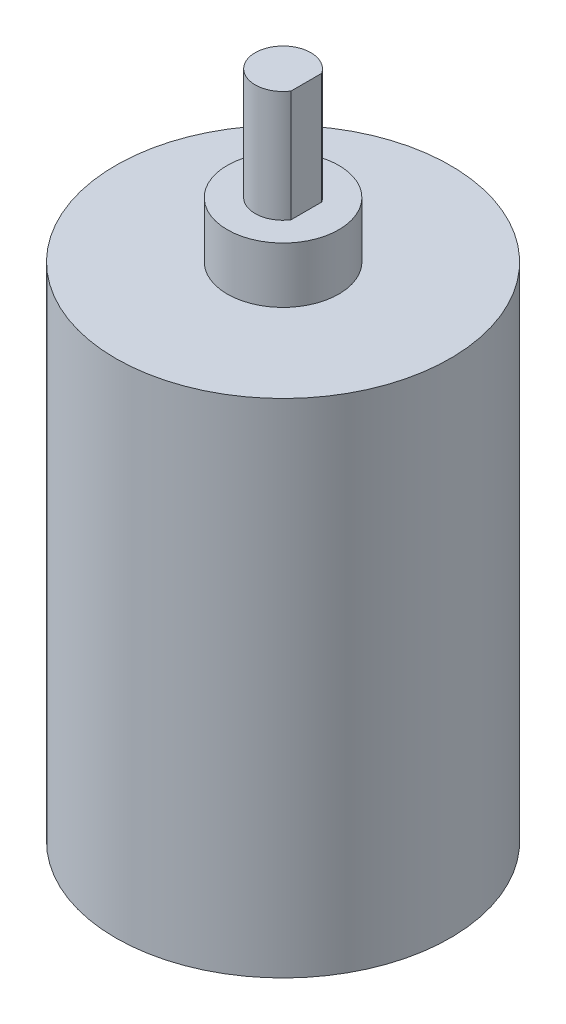
from build123d import *

# Parameters (mm, degrees)
SKETCH1_R           = 19.05
BOSS_EXTRUDE1_DEPTH = 57.15
SKETCH2_R           = 6.35
BOSS_EXTRUDE2_DEPTH = 6.35
SKETCH3_R           = 3.175
BOSS_EXTRUDE3_DEPTH = 12.7
CUT_EXTRUDE1_START  = -12.7
CUT_EXTRUDE1_DEPTH  = 12.7


with BuildPart() as part:
    # Sketch1 → Boss-Extrude1 (new body)
    with BuildSketch(Plane(origin=(0, 0, 0), x_dir=(1, 0, 0), z_dir=(0, 1, 0))):
        with Locations(Location((0, 0, 0), (0, 0, 270))):
            Circle(SKETCH1_R)
    extrude(amount=BOSS_EXTRUDE1_DEPTH)

    # Sketch2 → Boss-Extrude2 (add)
    with BuildSketch(Plane(origin=(0, 57.15, 0), x_dir=(1, 0, 0), z_dir=(0, 1, 0))):
        with Locations(Location((0, 0, 0), (0, 0, 270))):
            Circle(SKETCH2_R)
    extrude(amount=BOSS_EXTRUDE2_DEPTH)

    # Sketch3 → Boss-Extrude3 (add)
    with BuildSketch(Plane(origin=(0, 63.5, 0), x_dir=(1, 0, 0), z_dir=(0, 1, 0))):
        with Locations(Location((0, 0, 0), (0, 0, 270))):
            Circle(SKETCH3_R)
    extrude(amount=BOSS_EXTRUDE3_DEPTH)

    # Sketch4 → Cut-Extrude1 (cut)
    with BuildSketch(Plane(origin=(0, 76.2, 0), x_dir=(1, 0, 0), z_dir=(0, 1, 0)).offset(CUT_EXTRUDE1_START)):
        with BuildLine():
            Line((2.648755319, 1.750634245), (2.648755319, -1.750634245))
            ThreePointArc((2.648755319, -1.750634245), (3.175, 0), (2.648755319, 1.750634245))
        make_face()
    extrude(amount=CUT_EXTRUDE1_DEPTH, mode=Mode.SUBTRACT)


solid = part.part
